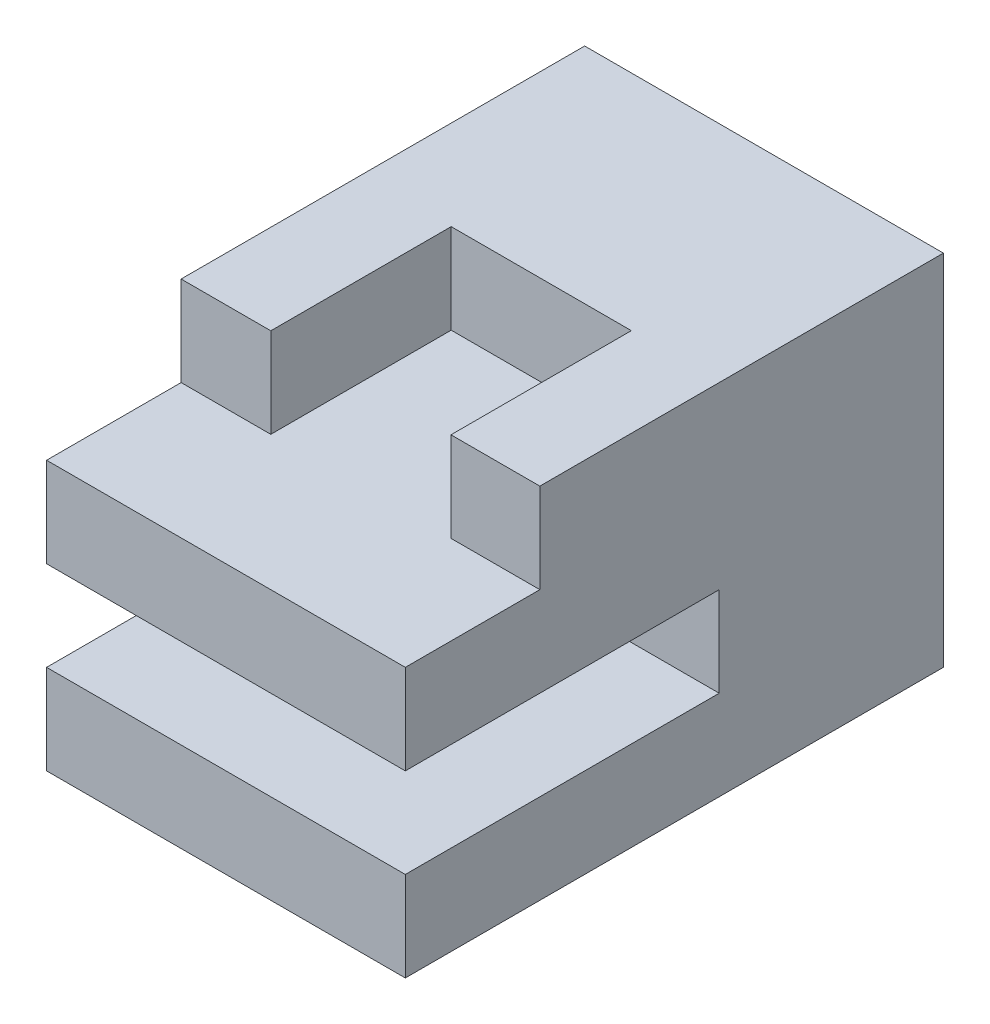
from build123d import *

# Parameters (mm, degrees)
SKETCH1_W           = 40
SKETCH1_H           = 40
BOSS_EXTRUDE1_DEPTH = 60
SKETCH2_W           = 40
SKETCH2_H           = 10
CUT_EXTRUDE1_DEPTH  = 35
SKETCH3_W           = 40
SKETCH3_H           = 10
CUT_EXTRUDE2_DEPTH  = 15
SKETCH4_W           = 20.089198479
SKETCH4_H           = 20.114051596
CUT_EXTRUDE3_DEPTH  = 10


with BuildPart() as part:
    # Sketch1 → Boss-Extrude1 (new body)
    with BuildSketch(Plane.XY):
        with Locations((20, 20)):
            Rectangle(SKETCH1_W, SKETCH1_H)
    extrude(amount=BOSS_EXTRUDE1_DEPTH)

    # Sketch2 → Cut-Extrude1 (cut)
    with BuildSketch(Plane.XY.offset(60)):
        with Locations((20, 15)):
            Rectangle(SKETCH2_W, SKETCH2_H)
    extrude(amount=-CUT_EXTRUDE1_DEPTH, mode=Mode.SUBTRACT)

    # Sketch3 → Cut-Extrude2 (cut)
    with BuildSketch(Plane.XY.offset(60)):
        with Locations((20, 35)):
            Rectangle(SKETCH3_W, SKETCH3_H)
    extrude(amount=-CUT_EXTRUDE2_DEPTH, mode=Mode.SUBTRACT)

    # Sketch4 → Cut-Extrude3 (cut)
    with BuildSketch(Plane(origin=(0, 40, 0), x_dir=(1, 0, 0), z_dir=(0, 1, 0))):
        with Locations((20.04459924, -34.942974202)):
            Rectangle(SKETCH4_W, SKETCH4_H)
    extrude(amount=-CUT_EXTRUDE3_DEPTH, mode=Mode.SUBTRACT)


solid = part.part
